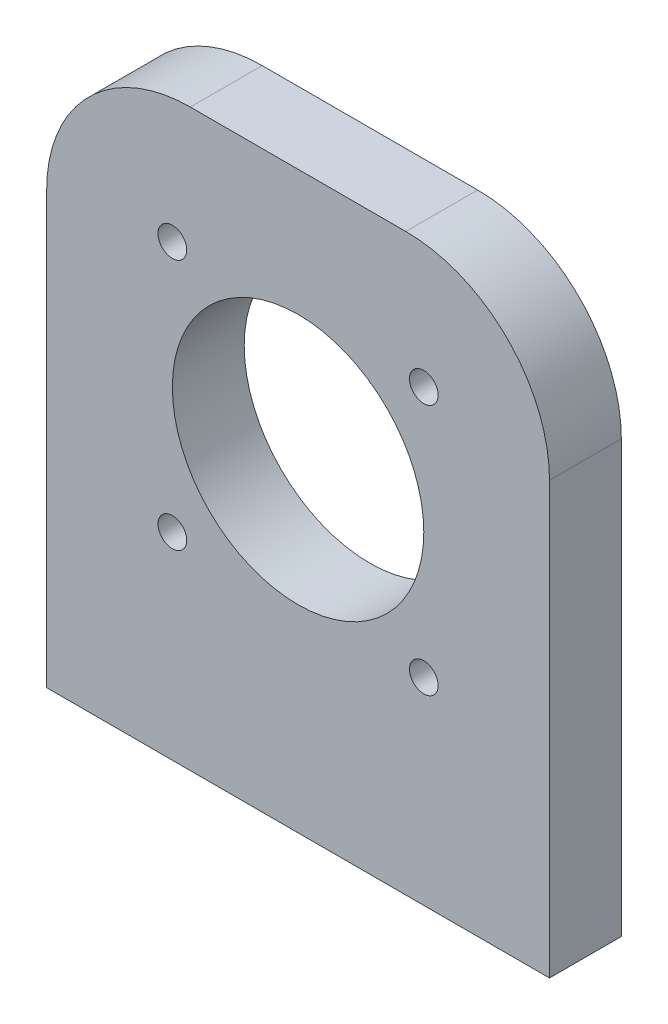
from build123d import *

# Parameters (mm, degrees)
SKETCH1_W           = 70
SKETCH1_H           = 80
SKETCH1_R           = 17.5
BOSS_EXTRUDE1_DEPTH = 10
FILLET1_R           = 20
SKETCH2_R           = 2
CUT_EXTRUDE1_DEPTH  = 10


with BuildPart() as part:
    # Sketch1 → Boss-Extrude1 (new body)
    with BuildSketch(Plane.XY):
        with Locations((35, -40)):
            Rectangle(SKETCH1_W, SKETCH1_H)
        with Locations((35, -35)):
            Circle(SKETCH1_R, mode=Mode.SUBTRACT)
    extrude(amount=BOSS_EXTRUDE1_DEPTH)

    # Fillet1
    fillet1_edges = [part.edges().sort_by_distance(p)[0] for p in [
        (0, 0, 5),
        (70, 0, 5),
    ]]
    fillet(fillet1_edges, radius=FILLET1_R)

    # Sketch2 → Cut-Extrude1 (cut)
    with BuildSketch(Plane.XY.offset(10)):
        with Locations((17.5, -17.5)):
            Circle(SKETCH2_R)
        with Locations((52.5, -17.5)):
            Circle(SKETCH2_R)
        with Locations((52.5, -52.5)):
            Circle(SKETCH2_R)
        with Locations((17.5, -52.5)):
            Circle(SKETCH2_R)
    extrude(amount=-CUT_EXTRUDE1_DEPTH, mode=Mode.SUBTRACT)


solid = part.part
